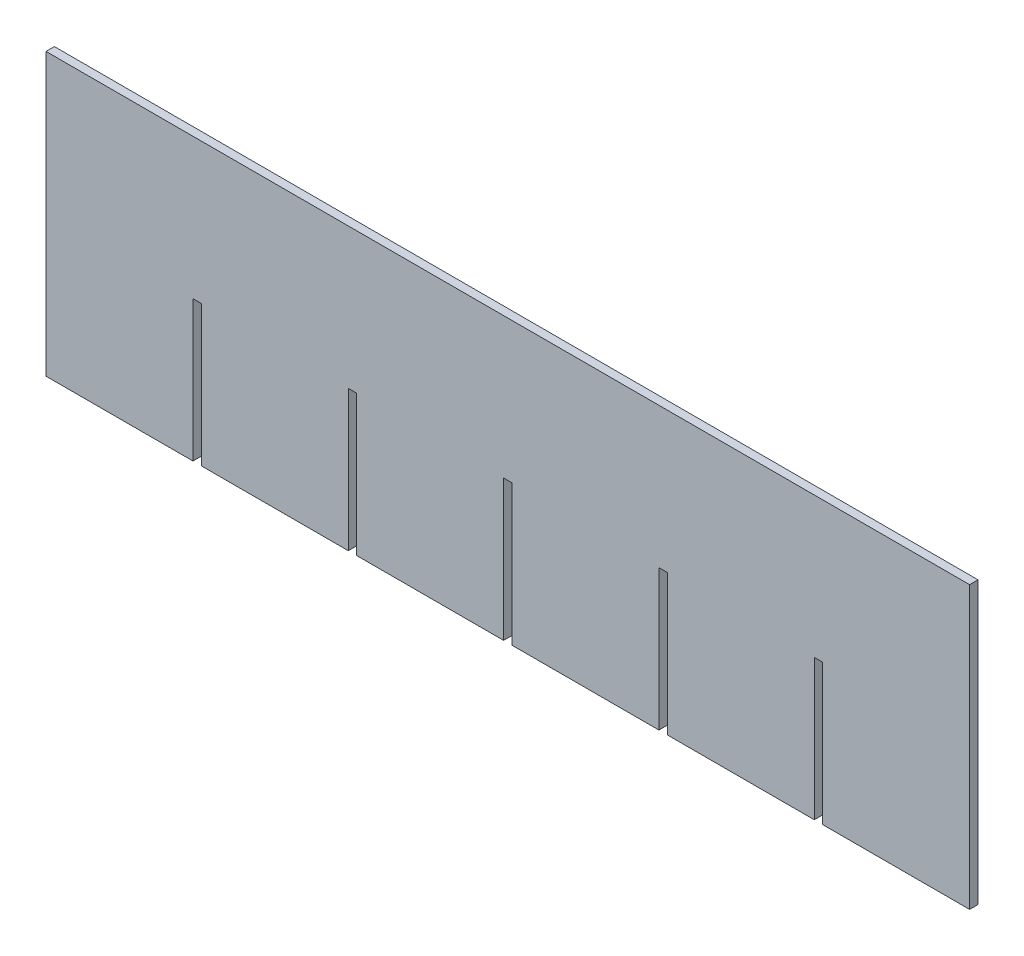
from build123d import *

# Parameters (mm, degrees)
SKETCH1_W           = 220
SKETCH1_H           = 67
BOSS_EXTRUDE1_DEPTH = 2
SKETCH2_W           = 2
SKETCH2_H           = 33.5
CUT_EXTRUDE1_DEPTH  = 116.005434654


with BuildPart() as part:
    # Sketch1 → Boss-Extrude1 (new body)
    with BuildSketch(Plane.XY):
        Rectangle(SKETCH1_W, SKETCH1_H)
    extrude(amount=BOSS_EXTRUDE1_DEPTH)

    # Sketch2 → Cut-Extrude1 (cut, through all)
    with BuildSketch(Plane.XY.offset(2)):
        with Locations((-37, -16.75)):
            Rectangle(SKETCH2_W, SKETCH2_H)
        with Locations((-74, -16.75)):
            Rectangle(SKETCH2_W, SKETCH2_H)
        with Locations((74, -16.75)):
            Rectangle(SKETCH2_W, SKETCH2_H)
        with Locations((37, -16.75)):
            Rectangle(SKETCH2_W, SKETCH2_H)
        with Locations((0, -16.75)):
            Rectangle(SKETCH2_W, SKETCH2_H)
    extrude(amount=-CUT_EXTRUDE1_DEPTH, mode=Mode.SUBTRACT)


solid = part.part
